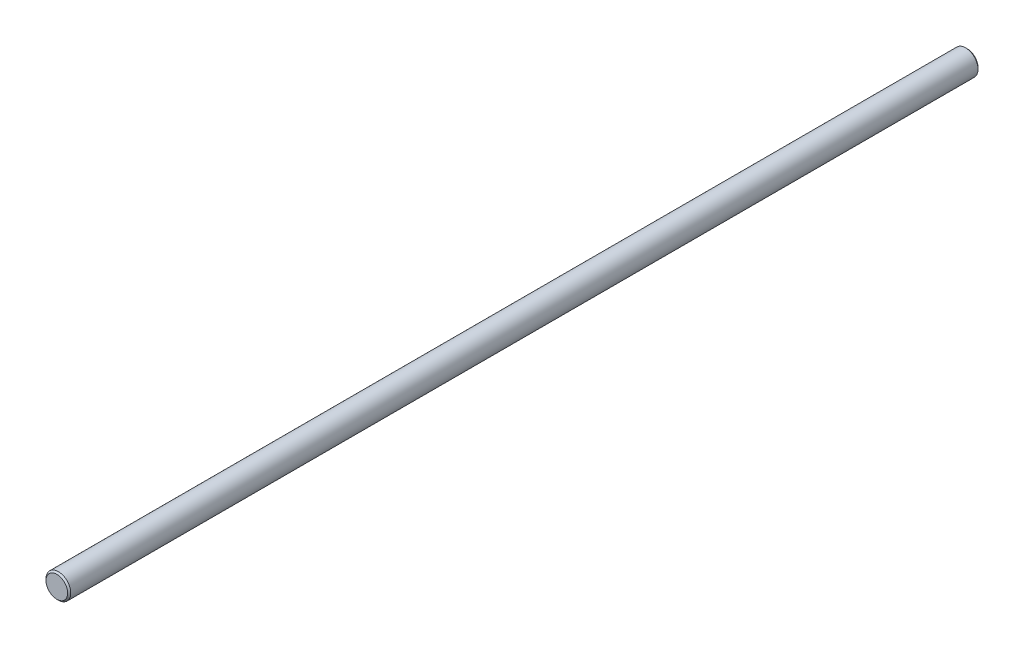
from build123d import *


with BuildPart() as part:
    # Sketch1 → Revolve1 (revolve)
    with BuildSketch(Plane.XZ, mode=Mode.PRIVATE) as revolve1_sk:
        Polygon((3.5, 294), (0, 294), (0, 0), (3.5, 0), (4, 0.5), (4, 293.5), align=None)
    revolve(revolve1_sk.sketch.rotate(Axis((0, 0, 294), (0, 0, -1)), 180), axis=Axis((0, 0, 294), (0, 0, -1)))


solid = part.part
